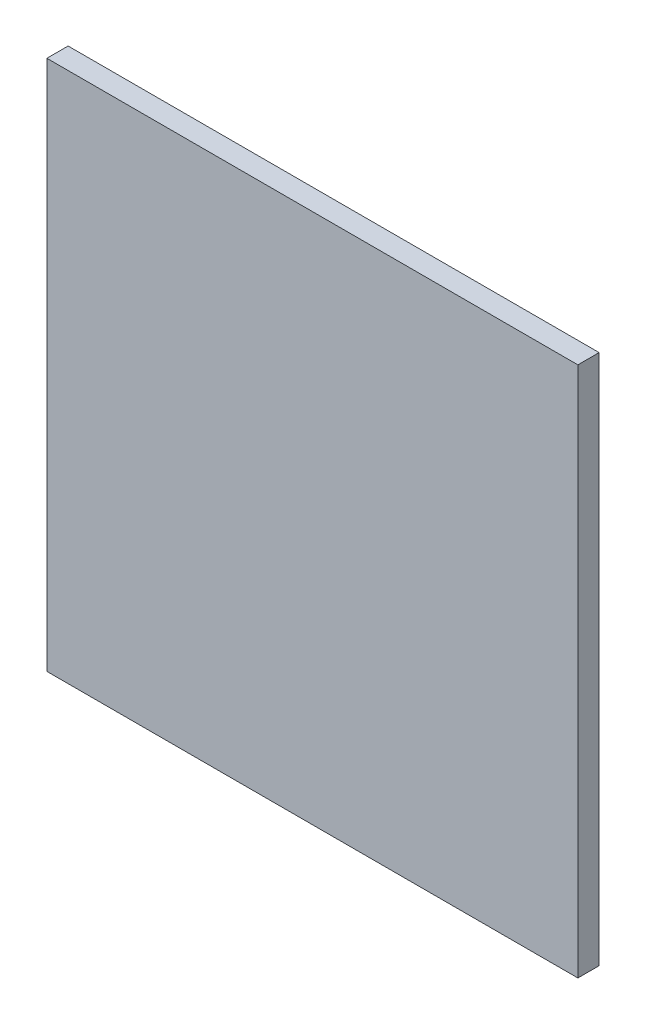
from build123d import *

# Parameters (mm, degrees)
SKETCH1_W           = 250
SKETCH1_H           = 250
BOSS_EXTRUDE1_DEPTH = 10


with BuildPart() as part:
    # Sketch1 → Boss-Extrude1 (new body)
    with BuildSketch(Plane.XY):
        Rectangle(SKETCH1_W, SKETCH1_H)
    extrude(amount=BOSS_EXTRUDE1_DEPTH)


solid = part.part
